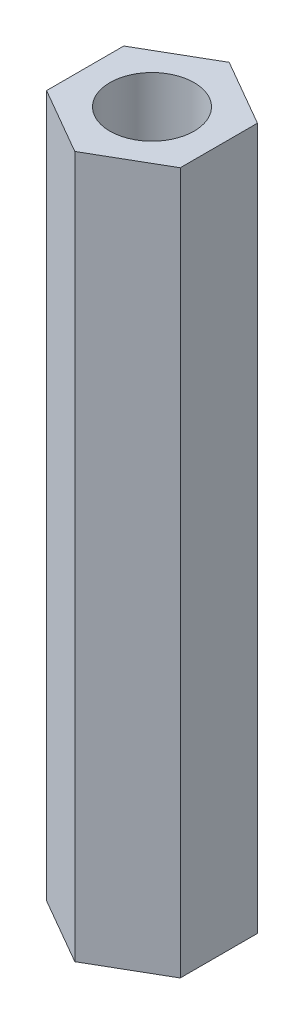
from build123d import *

# Parameters (mm, degrees)
SKETCH_1_R      = 1.5
EXTRUDE_1_DEPTH = 25


with BuildPart() as part:
    # 草图1 → 凸台-拉伸1 (new body)
    with BuildSketch(Plane(origin=(0, 0, 0), x_dir=(1, 0, 0), z_dir=(0, 1, 0))):
        Polygon((0, 2.75), (-2.38156986, 1.375), (-2.38156986, -1.375), (0, -2.75), (2.38156986, -1.375), (2.38156986, 1.375), align=None)
        with Locations(Location((0, 0, 0), (0, 0, 270))):
            Circle(SKETCH_1_R, mode=Mode.SUBTRACT)
    extrude(amount=EXTRUDE_1_DEPTH)


solid = part.part
